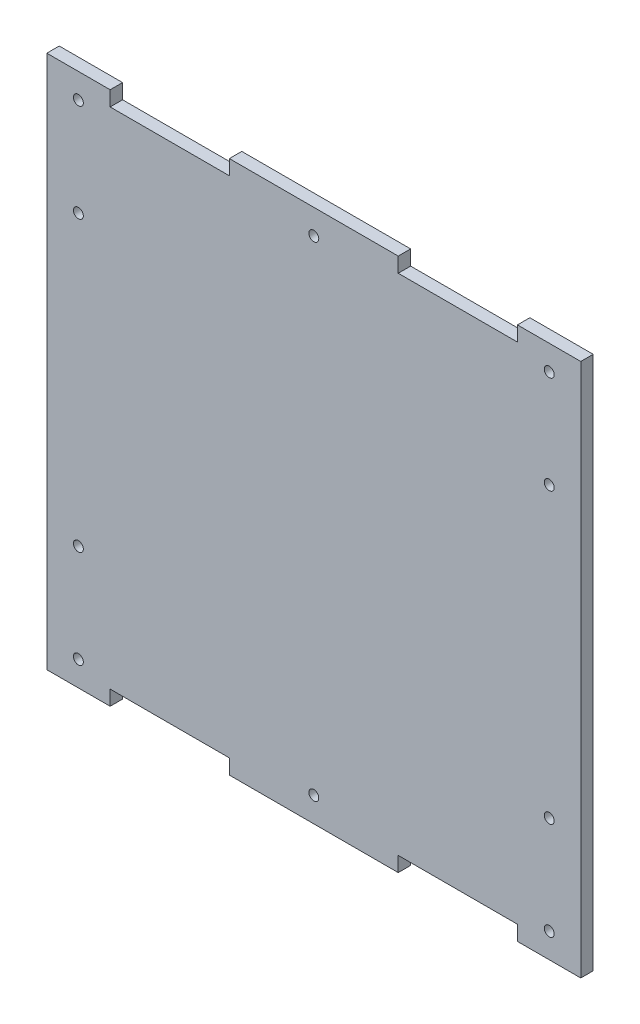
from build123d import *

# Parameters (mm, degrees)
SKETCH2_W           = 273.05
SKETCH2_H           = 273.05
SKETCH2_R           = 2.54
BOSS_EXTRUDE1_DEPTH = 6.35
SKETCH3_W           = 60.96
SKETCH3_H           = 17.280059867
CUT_EXTRUDE1_DEPTH  = 194.179899964


with BuildPart() as part:
    # Sketch2 → Boss-Extrude1 (new body)
    with BuildSketch(Plane.XY):
        Rectangle(SKETCH2_W, SKETCH2_H)
        with Locations((-120.396, 123.825)):
            Circle(SKETCH2_R, mode=Mode.SUBTRACT)
        with Locations((-120.396, 73.787)):
            Circle(SKETCH2_R, mode=Mode.SUBTRACT)
        with Locations((0, 123.825)):
            Circle(SKETCH2_R, mode=Mode.SUBTRACT)
        with Locations(Location((120.396, 73.787, 0), (0, 0, 180))):
            Circle(SKETCH2_R, mode=Mode.SUBTRACT)
        with Locations(Location((120.396, 123.825, 0), (0, 0, 180))):
            Circle(SKETCH2_R, mode=Mode.SUBTRACT)
        with Locations((120.396, -123.825)):
            Circle(SKETCH2_R, mode=Mode.SUBTRACT)
        with Locations((120.396, -73.787)):
            Circle(SKETCH2_R, mode=Mode.SUBTRACT)
        with Locations(Location((0, -123.825, 0), (0, 0, 180))):
            Circle(SKETCH2_R, mode=Mode.SUBTRACT)
        with Locations(Location((-120.396, -73.787, 0), (0, 0, 180))):
            Circle(SKETCH2_R, mode=Mode.SUBTRACT)
        with Locations(Location((-120.396, -123.825, 0), (0, 0, 180))):
            Circle(SKETCH2_R, mode=Mode.SUBTRACT)
    extrude(amount=BOSS_EXTRUDE1_DEPTH)

    # Sketch3 → Cut-Extrude1 (cut, through all)
    with BuildSketch(Plane.XY.offset(6.35)):
        with Locations((73.66, 137.545029934)):
            Rectangle(SKETCH3_W, SKETCH3_H)
        with Locations((-73.66, 137.545029934)):
            Rectangle(SKETCH3_W, SKETCH3_H)
        with Locations((-73.66, -137.545029934)):
            Rectangle(SKETCH3_W, SKETCH3_H)
        with Locations((73.66, -137.545029934)):
            Rectangle(SKETCH3_W, SKETCH3_H)
    extrude(amount=-CUT_EXTRUDE1_DEPTH, mode=Mode.SUBTRACT)


solid = part.part
